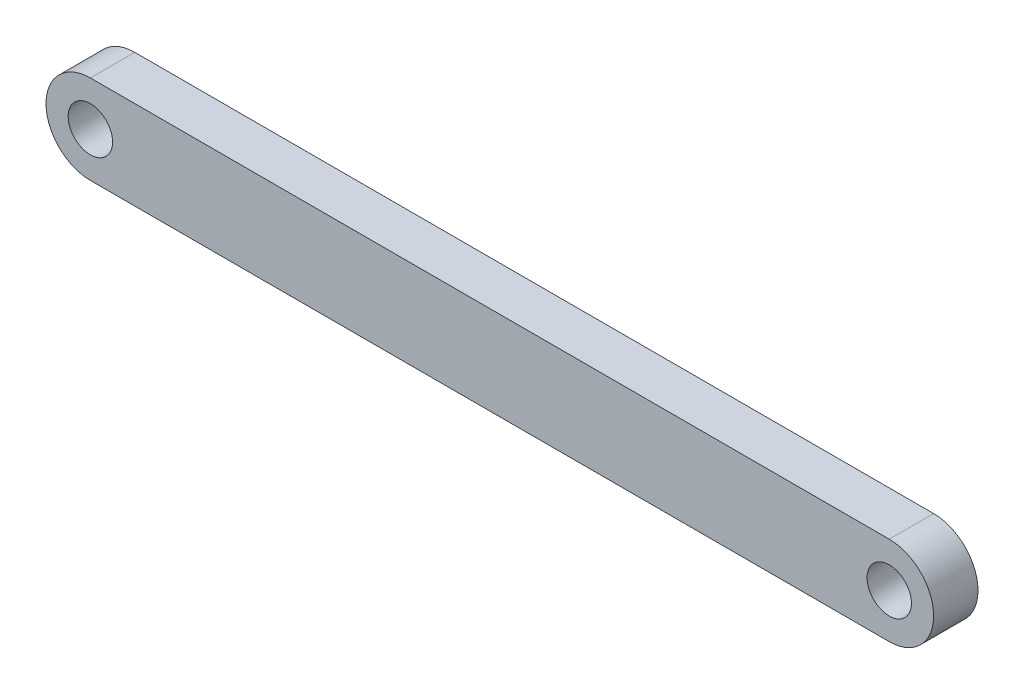
from build123d import *

# Parameters (mm, degrees)
CROQUIS1_R              = 1
SALIENTE_EXTRUIR1_DEPTH = 2


with BuildPart() as part:
    # Croquis1 → Saliente-Extruir1 (new body)
    with BuildSketch(Plane.XY):
        with BuildLine():
            Line((0, 2), (36, 2))
            ThreePointArc((36, 2), (38, 0), (36, -2))
            Line((36, -2), (0, -2))
            ThreePointArc((0, -2), (-2, 0), (0, 2))
        make_face()
        Circle(CROQUIS1_R, mode=Mode.SUBTRACT)
        with Locations((36, 0)):
            Circle(CROQUIS1_R, mode=Mode.SUBTRACT)
    extrude(amount=SALIENTE_EXTRUIR1_DEPTH)


solid = part.part
